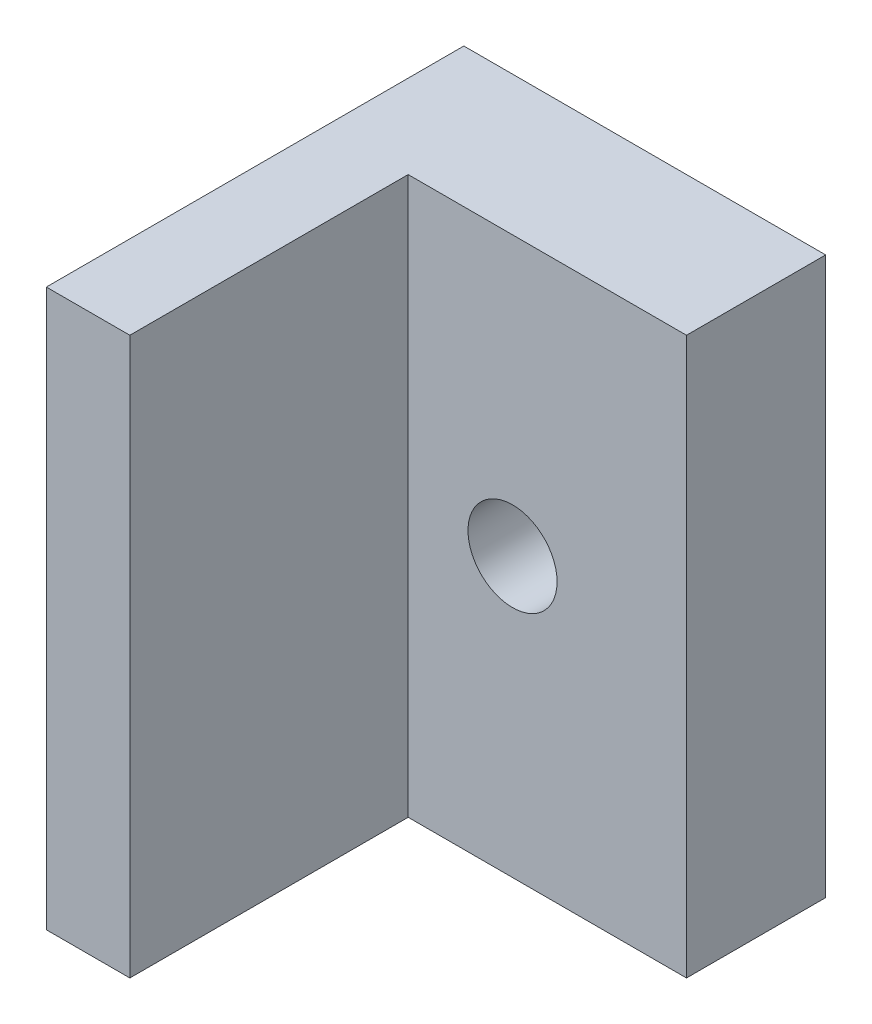
from build123d import *

# Parameters (mm, degrees)
SZKIC1_W                    = 10
SZKIC1_H                    = 20
SZKIC1_R                    = 1.6
SZKIC1_W_2                  = 3
DODANIE_WYCI_GNI_CIE1_DEPTH = 5
SZKIC2_W                    = 3
SZKIC2_H                    = 20
DODANIE_WYCI_GNI_CIE2_DEPTH = 10


with BuildPart() as part:
    # Szkic1 → Dodanie-wyciągnięcie1 (new body)
    # profile 1 of 2: a face of its own
    with BuildSketch(Plane.XY):
        with Locations((1.25, 0)):
            Rectangle(SZKIC1_W, SZKIC1_H)
        Circle(SZKIC1_R, mode=Mode.SUBTRACT)
    # profile 2 of 2: a face of its own
    with BuildSketch(Plane.XY):
        with Locations((-5.25, 0)):
            Rectangle(SZKIC1_W_2, SZKIC1_H)
    extrude(amount=DODANIE_WYCI_GNI_CIE1_DEPTH)

    # Szkic2 → Dodanie-wyciągnięcie2 (add)
    with BuildSketch(Plane.XY.offset(5)):
        with Locations((-5.25, 0)):
            Rectangle(SZKIC2_W, SZKIC2_H)
    extrude(amount=DODANIE_WYCI_GNI_CIE2_DEPTH)


solid = part.part
